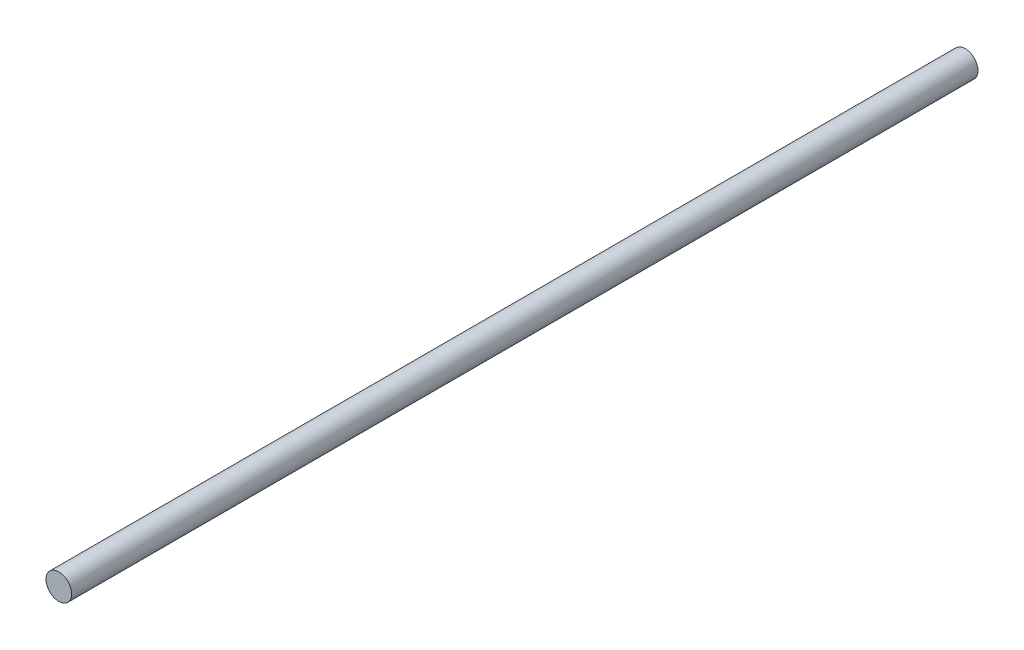
from build123d import *

# Parameters (mm, degrees)
SKETCH1_R           = 0.75
BOSS_EXTRUDE1_DEPTH = 53


with BuildPart() as part:
    # Sketch1 → Boss-Extrude1 (new body)
    with BuildSketch(Plane.XY):
        Circle(SKETCH1_R)
    extrude(amount=BOSS_EXTRUDE1_DEPTH)


solid = part.part
